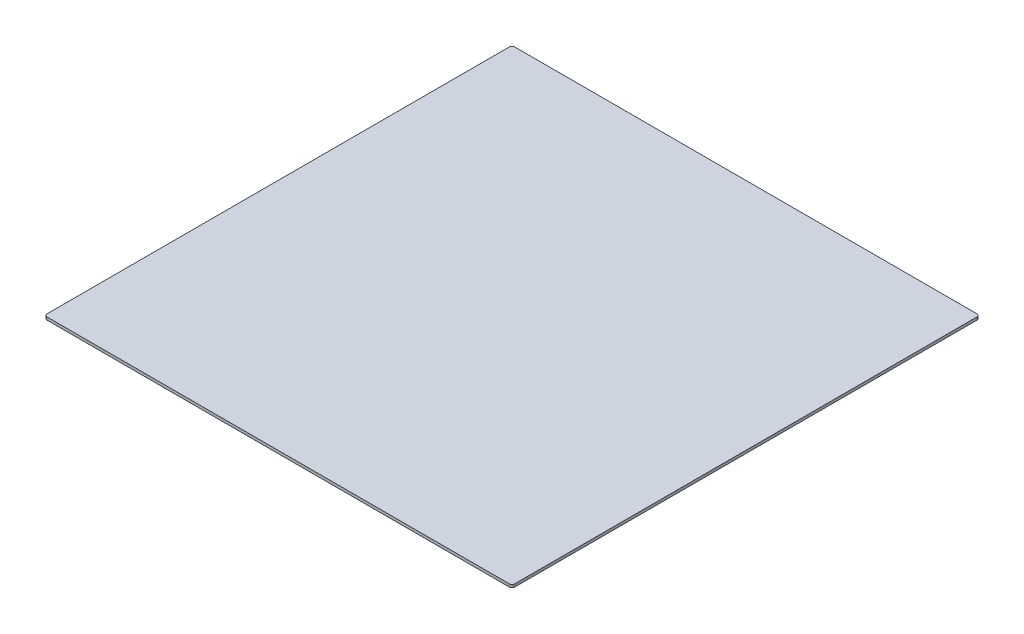
from build123d import *

# Parameters (mm, degrees)
SKETCH1_W           = 500
SKETCH1_H           = 500
BOSS_EXTRUDE1_DEPTH = 3
FILLET1_R           = 3


with BuildPart() as part:
    # Sketch1 → Boss-Extrude1 (new body)
    with BuildSketch(Plane(origin=(0, 0, 0), x_dir=(1, 0, 0), z_dir=(0, 1, 0))):
        Rectangle(SKETCH1_W, SKETCH1_H)
    extrude(amount=BOSS_EXTRUDE1_DEPTH)

    # Fillet1
    fillet1_edges = [part.edges().sort_by_distance(p)[0] for p in [
        (250, 1.5, 250),
        (-250, 1.5, 250),
        (-250, 1.5, -250),
        (250, 1.5, -250),
    ]]
    fillet(fillet1_edges, radius=FILLET1_R)


solid = part.part
